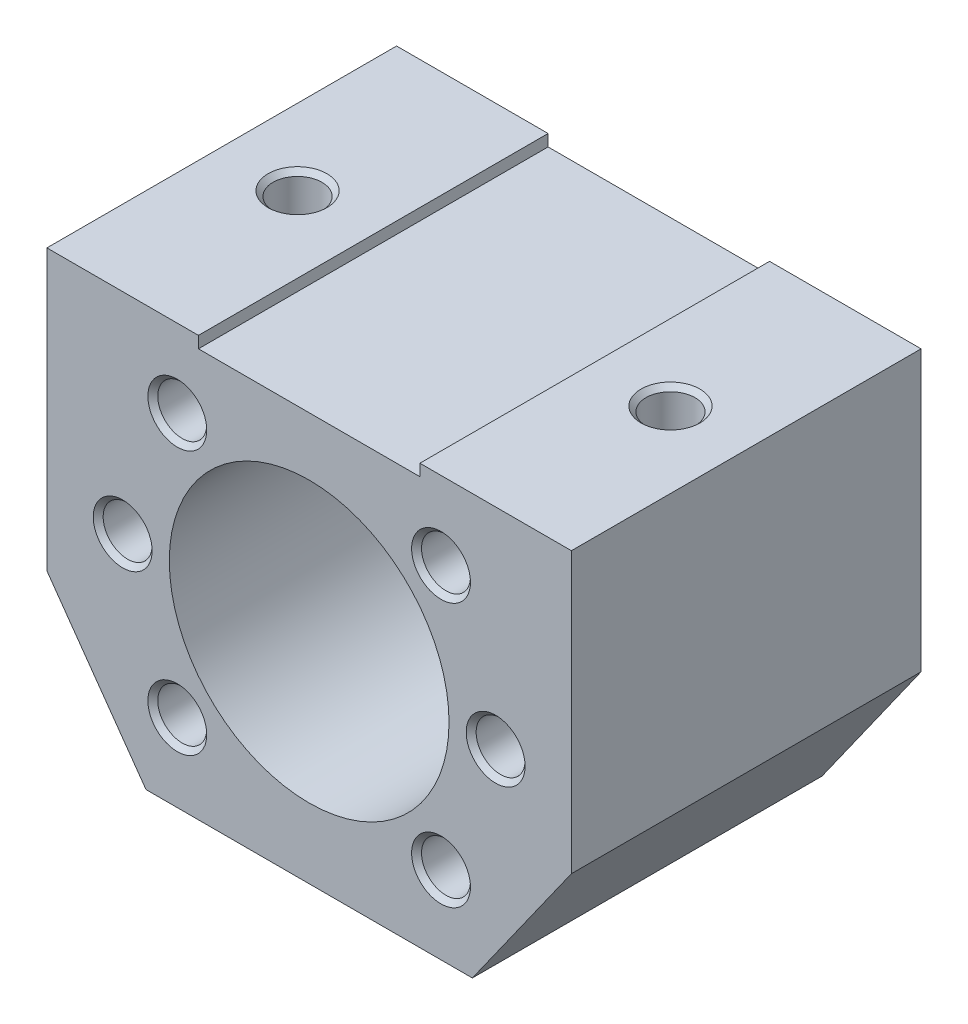
from build123d import *

# Parameters (mm, degrees)
SKETCH_1_R                   = 12
EXTRUDE_894_DEPTH            = 30
HOLE_WIZARD_5_D              = 4.2
HOLE_WIZARD_5_CSINK_D        = 5.05
HOLE_WIZARD_5_CSINK_ANGLE    = 90
PATTERN_CIRCULAR_1906_COUNT  = 8
SKETCH_27_W                  = 19
SKETCH_27_H                  = 30
CUT_EXTRUDE_2273_DEPTH       = 1
HOLE_WIZARD_2331_D           = 4.2
HOLE_WIZARD_2331_DEPTH       = 15
HOLE_WIZARD_2331_CSINK_D     = 5.05
HOLE_WIZARD_2331_CSINK_ANGLE = 90
HOLE_WIZARD_2331_TIP         = 1.2618073


with BuildPart() as part:
    # Эскиз1 → Extrude 894 (new body)
    with BuildSketch(Plane.XY):
        Polygon((-22.5, 18), (0, 18), (22.5, 18), (22.5, -6), (14, -18), (-14, -18), (-22.5, -6), align=None)
        Circle(SKETCH_1_R, mode=Mode.SUBTRACT)
    extrude(amount=-EXTRUDE_894_DEPTH)

    # Гайка М5 (through all)
    with Locations(Plane.XY):
        with Locations((-16, 0)):
            hole_wizard_5 = CounterSinkHole(HOLE_WIZARD_5_D / 2, HOLE_WIZARD_5_CSINK_D / 2, counter_sink_angle=HOLE_WIZARD_5_CSINK_ANGLE)

    # Pattern Circular 1906: Гайка М5 ×8 about axis, 2 skipped
    pattern_circular_1906_axis = Axis((0, 0, 0), (0, 0, 1))
    add([hole_wizard_5.rotate(pattern_circular_1906_axis, i * 360 / PATTERN_CIRCULAR_1906_COUNT) for i in range(1, PATTERN_CIRCULAR_1906_COUNT) if i not in (2, 6)], mode=Mode.SUBTRACT)

    # Эскиз27 → Cut-Extrude 2273 (cut)
    with BuildSketch(Plane(origin=(0, 18, 0), x_dir=(1, 0, 0), z_dir=(0, 1, 0))):
        with Locations((0, 15)):
            Rectangle(SKETCH_27_W, SKETCH_27_H)
    extrude(amount=-CUT_EXTRUDE_2273_DEPTH, mode=Mode.SUBTRACT)

    # Hole Wizard 2331
    with Locations(Plane(origin=(0, 18, 0), x_dir=(1, 0, 0), z_dir=(0, 1, 0))):
        with Locations((16, 15), (-16, 15)):
            CounterSinkHole(HOLE_WIZARD_2331_D / 2, HOLE_WIZARD_2331_CSINK_D / 2, depth=HOLE_WIZARD_2331_DEPTH, counter_sink_angle=HOLE_WIZARD_2331_CSINK_ANGLE)
            with Locations((0, 0, -(HOLE_WIZARD_2331_DEPTH + HOLE_WIZARD_2331_TIP / 2))):  # 118° drill point
                Cone(0, HOLE_WIZARD_2331_D / 2, HOLE_WIZARD_2331_TIP, mode=Mode.SUBTRACT)


solid = part.part
